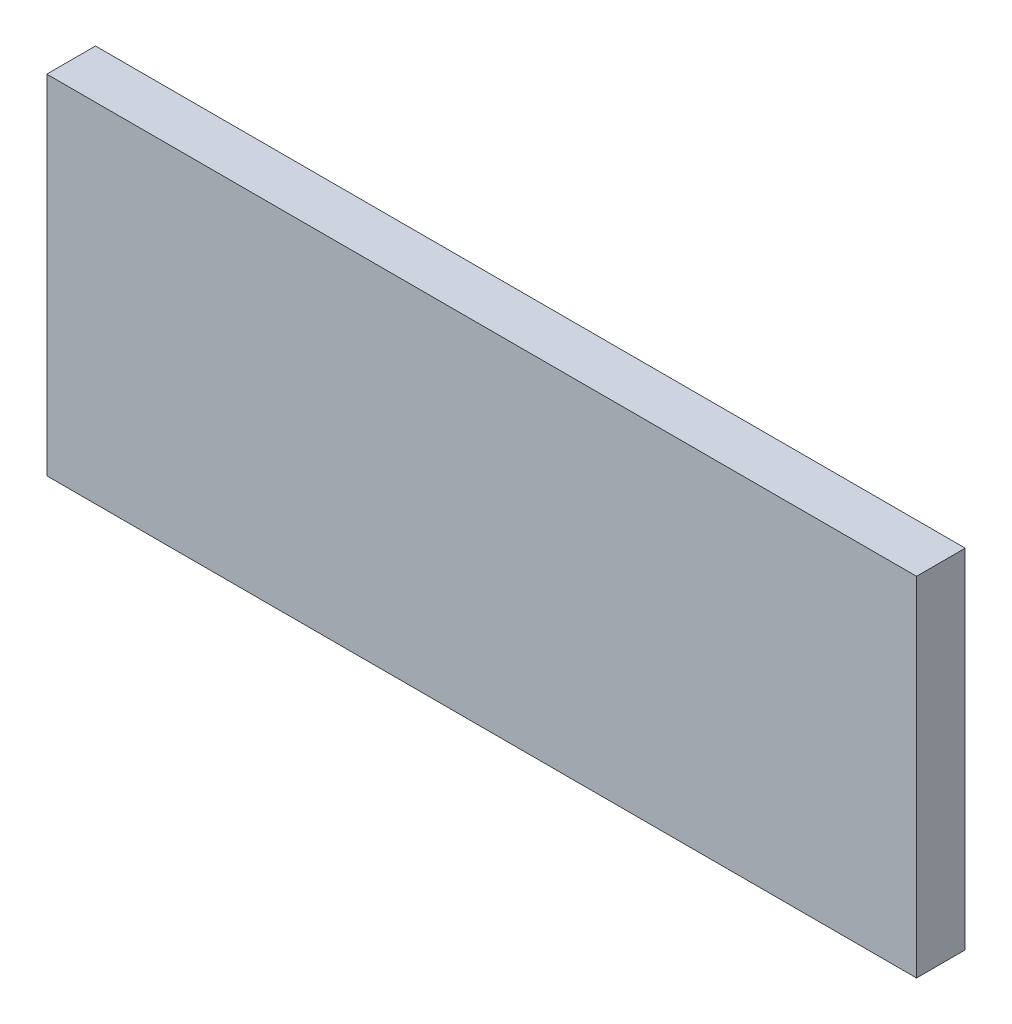
from build123d import *

# Parameters (mm, degrees)
BOSS_EXTRUDE2_DEPTH = 10
SKETCH2_W           = 250
SKETCH2_H           = 100
BOSS_EXTRUDE3_DEPTH = 4


with BuildPart() as part:
    # Sketch1 → Boss-Extrude2 (new body)
    with BuildSketch(Plane.XY):
        with BuildLine():
            Line((-49.595588235, 30.790441176), (-49.595588235, 55.790441176))
            Line((-49.595588235, 55.790441176), (-84.595588235, 55.790441176))
            Line((-84.595588235, 55.790441176), (-84.595588235, 5.790441176))
            Line((-84.595588235, 5.790441176), (-76.571127836, 5.790441176))
            Line((-76.571127836, 5.790441176), (-80.122995865, 8.369201143))
            Line((-80.122995865, 8.369201143), (-74.161024923, 10.431488509))
            ThreePointArc((-74.161024923, 10.431488509), (-65.548234046, 25.0391578), (-49.595588235, 30.790441176))
        make_face()
        with BuildLine():
            Line((10.404411765, 55.790441176), (-49.595588235, 55.790441176))
            Line((-49.595588235, 55.790441176), (-49.595588235, 30.790441176))
            ThreePointArc((-49.595588235, 30.790441176), (-46.420318597, 30.587974576), (-43.296479842, 29.983854194))
            Line((-43.296479842, 29.983854194), (-38.907655076, 38.5487403))
            Line((-38.907655076, 38.5487403), (-38.907655076, 28.390620042))
            ThreePointArc((-38.907655076, 28.390620042), (-30.648795615, 22.100531594), (-25.657089919, 12.997957973))
            Line((-25.657089919, 12.997957973), (-17.962154019, 12.997957973))
            Line((-17.962154019, 12.997957973), (-22.478851702, 5.790441176))
            Line((-22.478851702, 5.790441176), (-14.595588235, 5.790441176))
            ThreePointArc((-14.595588235, 5.790441176), (-12.499276658, 15.811471895), (-6.561903703, 24.151926396))
            Line((-6.561903703, 24.151926396), (-6.561903703, 35.084441479))
            Line((-6.561903703, 35.084441479), (0, 28.522537776))
            ThreePointArc((0, 28.522537776), (5.080053353, 30.216886016), (10.404411765, 30.790441176))
            Line((10.404411765, 30.790441176), (10.404411765, 55.790441176))
        make_face()
        with BuildLine():
            Line((70.404411765, 55.790441176), (10.404411765, 55.790441176))
            Line((10.404411765, 55.790441176), (10.404411765, 30.790441176))
            ThreePointArc((10.404411765, 30.790441176), (17.859813508, 29.652900917), (24.63674968, 26.343799964))
            Line((24.63674968, 26.343799964), (32.552494412, 30.790441176))
            Line((32.552494412, 30.790441176), (29.92126971, 21.41389329))
            ThreePointArc((29.92126971, 21.41389329), (33.993831518, 14.069286246), (35.404411765, 5.790441176))
            Line((35.404411765, 5.790441176), (45.404411765, 5.790441176))
            ThreePointArc((45.404411765, 5.790441176), (50.185133178, 20.493528384), (62.698873639, 29.573306483))
            Line((62.698873639, 29.573306483), (67.171172857, 38.5487403))
            Line((67.171172857, 38.5487403), (70.404411765, 30.790441176))
            Line((70.404411765, 30.790441176), (70.404411765, 55.790441176))
        make_face()
        with BuildLine():
            Line((130.404411765, 55.790441176), (70.404411765, 55.790441176))
            Line((70.404411765, 55.790441176), (70.404411765, 30.790441176))
            ThreePointArc((70.404411765, 30.790441176), (83.787720088, 26.906479118), (93.012607471, 16.461405843))
            Line((93.012607471, 16.461405843), (98.474145882, 18.660683713))
            Line((98.474145882, 18.660683713), (94.969848452, 10.431488509))
            ThreePointArc((94.969848452, 10.431488509), (95.295533849, 8.1211152), (95.404411765, 5.790441176))
            Line((95.404411765, 5.790441176), (105.404411765, 5.790441176))
            ThreePointArc((105.404411765, 5.790441176), (106.107781477, 11.678883811), (108.178312298, 17.23598627))
            Line((108.178312298, 17.23598627), (105.404411765, 23.549684511))
            Line((105.404411765, 23.549684511), (110.88755382, 21.41389329))
            ThreePointArc((110.88755382, 21.41389329), (119.578200582, 28.324707338), (130.404411765, 30.790441176))
            Line((130.404411765, 30.790441176), (130.404411765, 55.790441176))
        make_face()
        with BuildLine():
            Line((165.404411765, 55.790441176), (130.404411765, 55.790441176))
            Line((130.404411765, 55.790441176), (130.404411765, 30.790441176))
            ThreePointArc((130.404411765, 30.790441176), (133.401752606, 30.610109746), (136.355852267, 30.071717007))
            Line((136.355852267, 30.071717007), (140.818257218, 36.687543597))
            Line((140.818257218, 36.687543597), (142.579811014, 27.625267787))
            ThreePointArc((142.579811014, 27.625267787), (151.961139035, 18.451701358), (155.404411765, 5.790441176))
            Line((155.404411765, 5.790441176), (165.404411765, 5.790441176))
            Line((165.404411765, 5.790441176), (165.404411765, 55.790441176))
        make_face()
        with BuildLine():
            Line((165.404411765, -44.209558824), (165.404411765, 5.790441176))
            Line((165.404411765, 5.790441176), (155.404411765, 5.790441176))
            ThreePointArc((155.404411765, 5.790441176), (151.961139035, -6.870819005), (142.579811014, -16.044385434))
            Line((142.579811014, -16.044385434), (139.723435627, -21.807209952))
            Line((139.723435627, -21.807209952), (132.176529952, -19.14667167))
            ThreePointArc((132.176529952, -19.14667167), (131.291028602, -19.193832089), (130.404411765, -19.209558824))
            Line((130.404411765, -19.209558824), (130.404411765, -44.209558824))
            Line((130.404411765, -44.209558824), (165.404411765, -44.209558824))
        make_face()
        with BuildLine():
            ThreePointArc((78.603951233, -17.826661789), (74.562080934, -18.861410419), (70.404411765, -19.209558824))
            Line((70.404411765, -19.209558824), (70.404411765, -44.209558824))
            Line((70.404411765, -44.209558824), (130.404411765, -44.209558824))
            Line((130.404411765, -44.209558824), (130.404411765, -19.209558824))
            ThreePointArc((130.404411765, -19.209558824), (124.758153779, -18.563609221), (119.403671642, -16.659140484))
            Line((119.403671642, -16.659140484), (108.178312298, -21.807209952))
            Line((108.178312298, -21.807209952), (110.88755382, -9.833010937))
            ThreePointArc((110.88755382, -9.833010937), (106.814992011, -2.488403893), (105.404411765, 5.790441176))
            Line((105.404411765, 5.790441176), (95.404411765, 5.790441176))
            ThreePointArc((95.404411765, 5.790441176), (92.88136777, -5.154258396), (85.821495865, -13.889841287))
            Line((85.821495865, -13.889841287), (89.988841167, -19.209558824))
            Line((89.988841167, -19.209558824), (78.603951233, -17.826661789))
        make_face()
        with BuildLine():
            ThreePointArc((16.26584722, -18.512718585), (13.35576789, -19.034737514), (10.404411765, -19.209558824))
            Line((10.404411765, -19.209558824), (10.404411765, -44.209558824))
            Line((10.404411765, -44.209558824), (70.404411765, -44.209558824))
            Line((70.404411765, -44.209558824), (70.404411765, -19.209558824))
            ThreePointArc((70.404411765, -19.209558824), (66.503875434, -18.903400492), (62.698873639, -17.99242413))
            Line((62.698873639, -17.99242413), (57.774840306, -22.916457463))
            Line((57.774840306, -22.916457463), (57.774840306, -15.784867043))
            ThreePointArc((57.774840306, -15.784867043), (48.716404866, -6.644604331), (45.404411765, 5.790441176))
            Line((45.404411765, 5.790441176), (35.404411765, 5.790441176))
            ThreePointArc((35.404411765, 5.790441176), (32.092418663, -6.644604331), (23.033983223, -15.784867043))
            Line((23.033983223, -15.784867043), (24.63674968, -26.883621045))
            Line((24.63674968, -26.883621045), (16.26584722, -18.512718585))
        make_face()
        with BuildLine():
            ThreePointArc((-24.894580949, 1.935543121), (-33.337858557, -13.20129981), (-49.595588235, -19.209558824))
            Line((-49.595588235, -19.209558824), (-49.595588235, -44.209558824))
            Line((-49.595588235, -44.209558824), (10.404411765, -44.209558824))
            Line((10.404411765, -44.209558824), (10.404411765, -19.209558824))
            ThreePointArc((10.404411765, -19.209558824), (0.386918535, -17.114794674), (-7.951831841, -11.181545175))
            Line((-7.951831841, -11.181545175), (-15.042390882, -13.889841287))
            Line((-15.042390882, -13.889841287), (-11.571398063, -6.128610062))
            ThreePointArc((-11.571398063, -6.128610062), (-13.827749155, -0.357922603), (-14.595588235, 5.790441176))
            Line((-14.595588235, 5.790441176), (-22.478851702, 5.790441176))
            Line((-22.478851702, 5.790441176), (-24.894580949, 1.935543121))
        make_face()
        with BuildLine():
            Line((-76.571127836, 5.790441176), (-84.595588235, 5.790441176))
            Line((-84.595588235, 5.790441176), (-84.595588235, -44.209558824))
            Line((-84.595588235, -44.209558824), (-49.595588235, -44.209558824))
            Line((-49.595588235, -44.209558824), (-49.595588235, -19.209558824))
            ThreePointArc((-49.595588235, -19.209558824), (-55.612209406, -18.474765802), (-61.275152877, -16.313580398))
            Line((-61.275152877, -16.313580398), (-69.988075999, -18.512718585))
            Line((-69.988075999, -18.512718585), (-67.951831841, -11.181545175))
            ThreePointArc((-67.951831841, -11.181545175), (-72.598243173, -4.001283177), (-74.552596729, 4.324928615))
            Line((-74.552596729, 4.324928615), (-76.571127836, 5.790441176))
        make_face()
    extrude(amount=BOSS_EXTRUDE2_DEPTH)

    # Sketch2 → Boss-Extrude3 (add)
    with BuildSketch(Plane.XY.offset(10)):
        with Locations((40.404411765, 5.790441176)):
            Rectangle(SKETCH2_W, SKETCH2_H)
    extrude(amount=BOSS_EXTRUDE3_DEPTH)


solid = part.part
